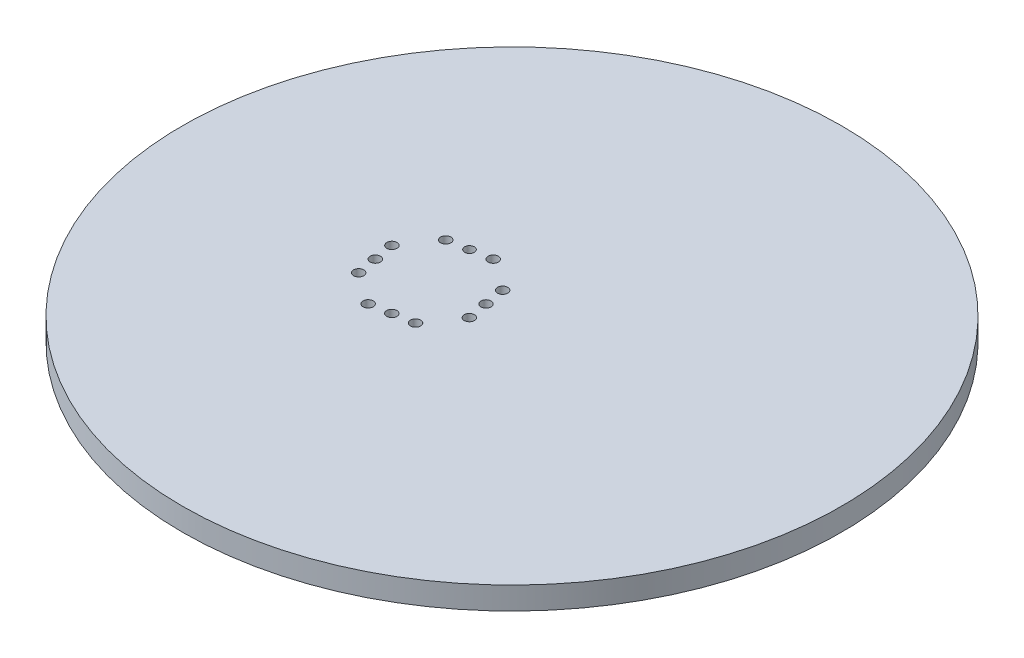
from build123d import *

# Parameters (mm, degrees)
SKETCH1_R           = 48.26
BOSS_EXTRUDE1_DEPTH = 3.302
SKETCH2_R           = 0.75
SKETCH2_R_2         = 0.70671089
CUT_EXTRUDE1_DEPTH  = 7.62


with BuildPart() as part:
    # Sketch1 → Boss-Extrude1 (new body)
    with BuildSketch(Plane(origin=(0, 0, 0), x_dir=(1, 0, 0), z_dir=(0, 1, 0))):
        with Locations(Location((0, 0, 0), (0, 0, 90))):
            Circle(SKETCH1_R)
    extrude(amount=BOSS_EXTRUDE1_DEPTH)

    # Sketch2 → Cut-Extrude1 (cut)
    with BuildSketch(Plane(origin=(0, 3.302, 0), x_dir=(1, 0, 0), z_dir=(0, 1, 0))):
        with Locations(Location((-17.223919858, -2.793785138, 0), (0, 0, 270))):
            Circle(SKETCH2_R)
        with Locations(Location((-17.742361425, 0.161078368, 0), (0, 0, 270))):
            Circle(SKETCH2_R)
        with Locations(Location((-14.49379884, 4.7921518, 0), (0, 0, 270))):
            Circle(SKETCH2_R)
        with Locations(Location((-16.70547829, -5.748648644, 0), (0, 0, 270))):
            Circle(SKETCH2_R)
        with Locations(Location((-12.074404858, -8.99721123, 0), (0, 0, 270))):
            Circle(SKETCH2_R)
        with Locations(Location((-9.119541352, -8.478769662, 0), (0, 0, 270))):
            Circle(SKETCH2_R)
        with Locations(Location((-6.164677846, -7.960328095, 0), (0, 0, 270))):
            Circle(SKETCH2_R)
        with Locations(Location((-2.91611526, -3.329254663, 0), (0, 0, 270))):
            Circle(SKETCH2_R)
        with Locations(Location((-3.434556828, -0.374391157, 0), (0, 0, 270))):
            Circle(SKETCH2_R)
        with Locations(Location((-3.952998395, 2.58047235, 0), (0, 0, 270))):
            Circle(SKETCH2_R)
        with Locations(Location((-8.584071827, 5.829034935, 0), (0, 0, 270))):
            Circle(SKETCH2_R)
        with Locations(Location((-11.538935333, 5.310593367, 0), (0, 0, 270))):
            Circle(SKETCH2_R_2)
    extrude(amount=-CUT_EXTRUDE1_DEPTH, mode=Mode.SUBTRACT)


solid = part.part
